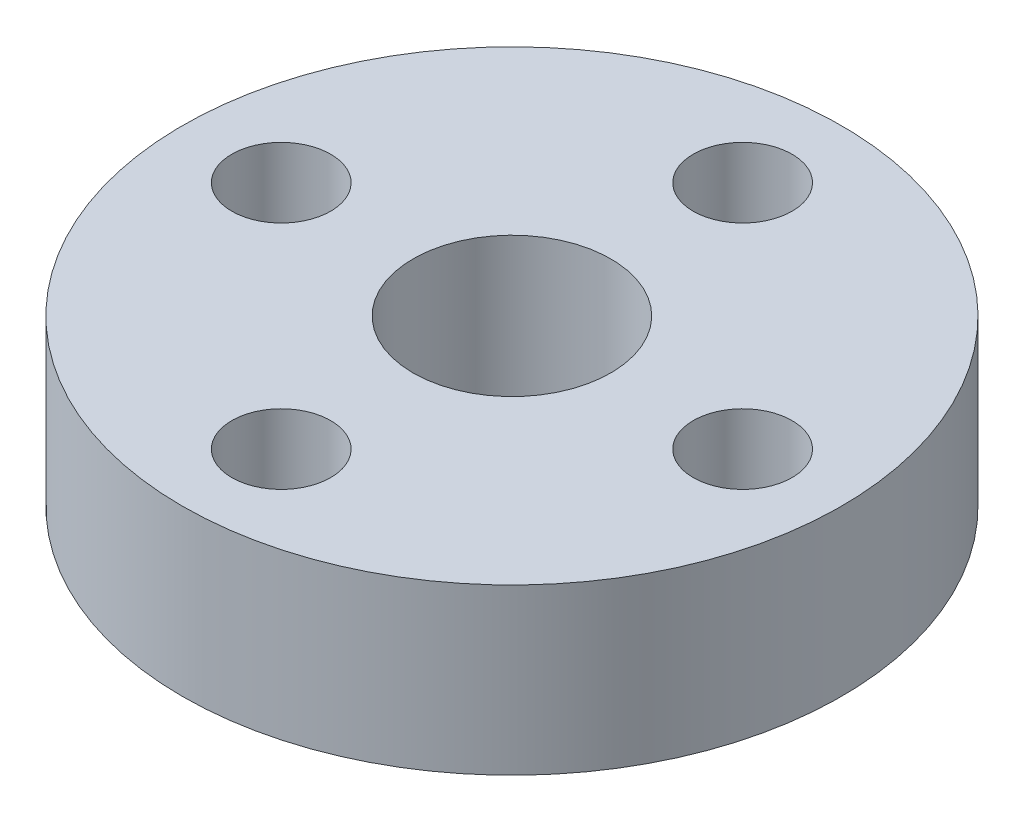
from build123d import *

# Parameters (mm, degrees)
SKETCH_1_R      = 10
SKETCH_1_R_2    = 1.5
SKETCH_1_R_3    = 3
EXTRUDE_1_DEPTH = 5


with BuildPart() as part:
    # Эскиз1 → Бобышка-Вытянуть1 (new body)
    with BuildSketch(Plane(origin=(0, 0, 0), x_dir=(1, 0, 0), z_dir=(0, 1, 0))):
        with Locations(Location((0, 0, 0), (0, 0, 270))):
            Circle(SKETCH_1_R)
        with Locations(Location((-7, 0, 0), (0, 0, 270))):
            Circle(SKETCH_1_R_2, mode=Mode.SUBTRACT)
        with Locations(Location((0, 7, 0), (0, 0, 270))):
            Circle(SKETCH_1_R_2, mode=Mode.SUBTRACT)
        with Locations(Location((7, 0, 0), (0, 0, 270))):
            Circle(SKETCH_1_R_2, mode=Mode.SUBTRACT)
        with Locations(Location((0, -7, 0), (0, 0, 270))):
            Circle(SKETCH_1_R_2, mode=Mode.SUBTRACT)
        with Locations(Location((0, 0, 0), (0, 0, 270))):
            Circle(SKETCH_1_R_3, mode=Mode.SUBTRACT)
    extrude(amount=EXTRUDE_1_DEPTH)


solid = part.part
